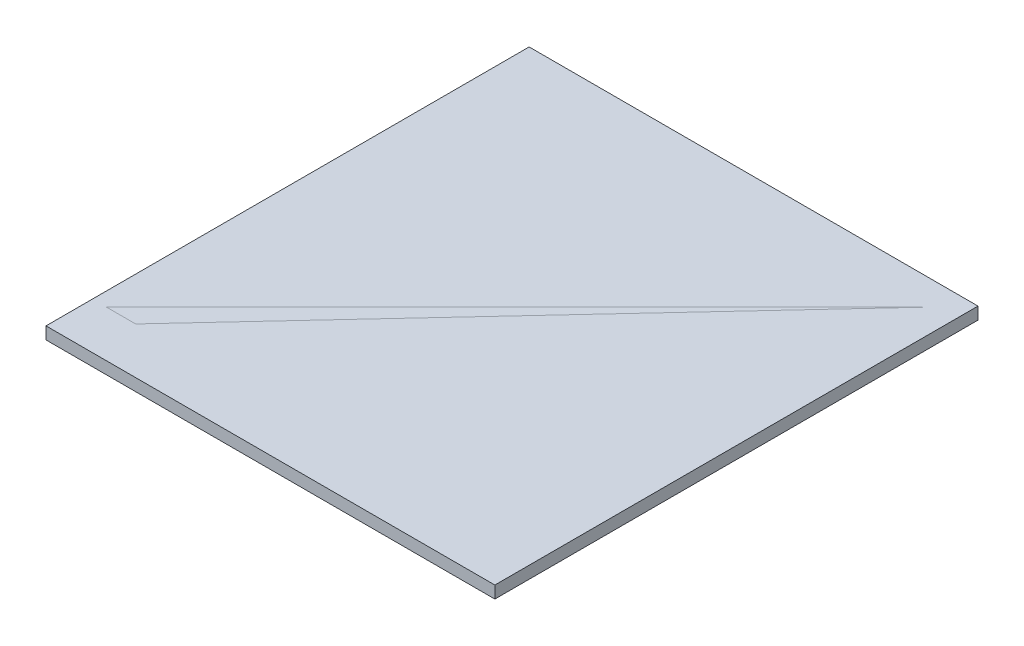
from build123d import *

# Parameters (mm, degrees)
SKETCH1_W           = 29.46
SKETCH1_H           = 31.71
BOSS_EXTRUDE1_DEPTH = 0.8


with BuildPart() as part:
    # Sketch1 → Boss-Extrude1 (new body)
    with BuildSketch(Plane(origin=(0, 0, 0), x_dir=(1, 0, 0), z_dir=(0, 1, 0))):
        with Locations((14.73, 15.855)):
            Rectangle(SKETCH1_W, SKETCH1_H)
    extrude(amount=BOSS_EXTRUDE1_DEPTH)


solid = part.part
